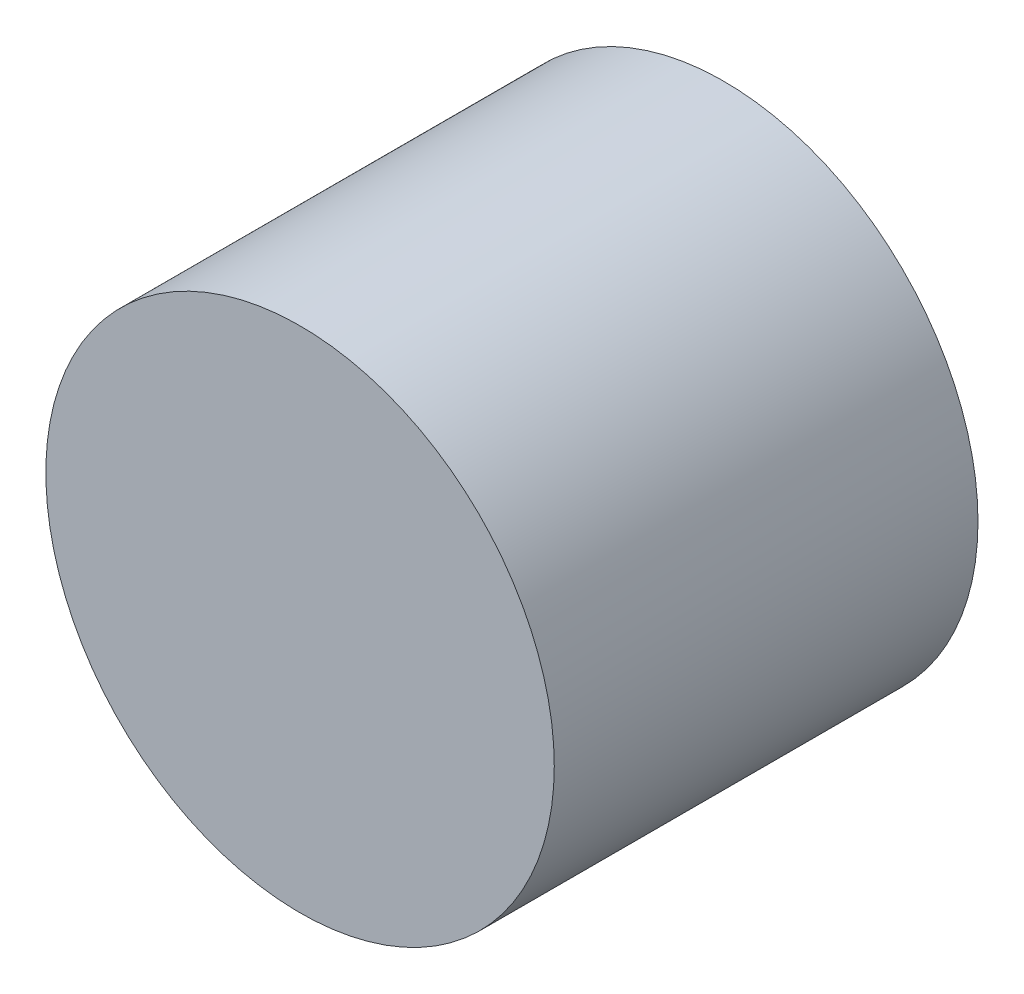
from build123d import *

# Parameters (mm, degrees)
SKETCH1_R           = 6
BOSS_EXTRUDE1_DEPTH = 10


with BuildPart() as part:
    # Sketch1 → Boss-Extrude1 (new body)
    with BuildSketch(Plane.XY):
        Circle(SKETCH1_R)
    extrude(amount=BOSS_EXTRUDE1_DEPTH)


solid = part.part
